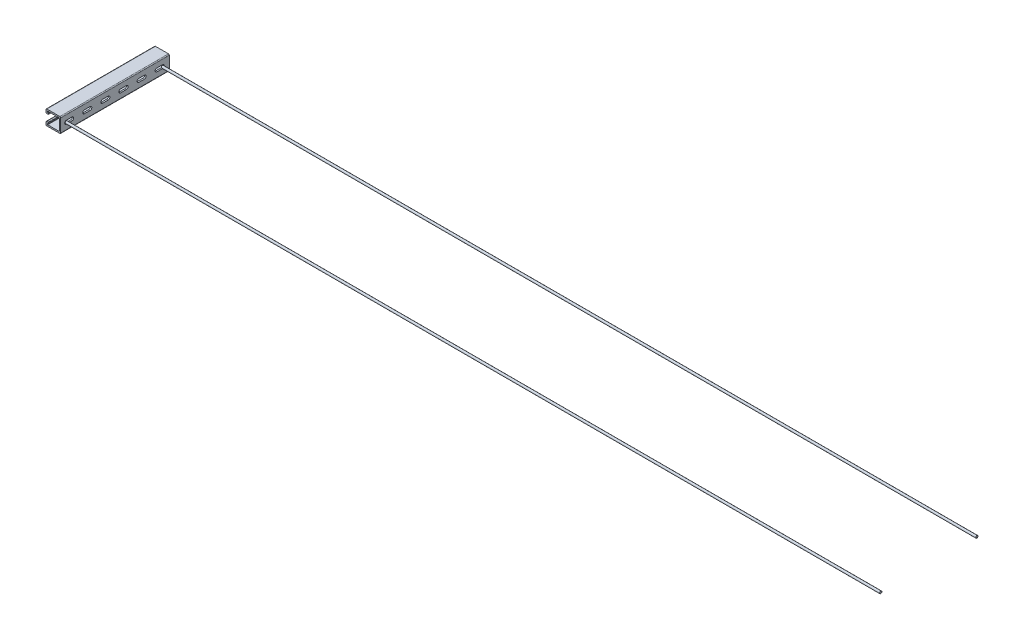
from build123d import *

# Parameters (mm, degrees)
EXTRUDE_THIN1_DEPTH   = 304.8
FILLET2_R             = 0.762
FILLET3_R             = 1.524
CUT_EXTRUDE1_DEPTH    = 309.273534432
LPATTERN1_COUNT       = 6
LPATTERN1_PITCH       = 50.8
SKETCH4_R             = 3.175
BOSS_EXTRUDE1_DEPTH   = 2286
BOSS_EXTRUDE1_2_DEPTH = 2286


with BuildPart() as part:
    # Sketch1 → Extrude-Thin1 (new body)
    with BuildSketch(Plane.XY):
        with BuildLine():
            Line((-13.5255, 9.525), (-18.2499, 9.525))
            ThreePointArc((-18.2499, 9.525), (-19.938188151, 10.224311849), (-20.6375, 11.9126))
            Line((-20.6375, 11.9126), (-20.6375, 18.2499))
            ThreePointArc((-20.6375, 18.2499), (-19.938188151, 19.938188151), (-18.2499, 20.6375))
            Line((-18.2499, 20.6375), (18.2499, 20.6375))
            ThreePointArc((18.2499, 20.6375), (19.938188151, 19.938188151), (20.6375, 18.2499))
            Line((20.6375, 18.2499), (20.6375, -18.2499))
            ThreePointArc((20.6375, -18.2499), (19.938188151, -19.938188151), (18.2499, -20.6375))
            Line((18.2499, -20.6375), (-18.2499, -20.6375))
            ThreePointArc((-18.2499, -20.6375), (-19.938188151, -19.938188151), (-20.6375, -18.2499))
            Line((-20.6375, -18.2499), (-20.6375, -11.9126))
            ThreePointArc((-20.6375, -11.9126), (-19.938188151, -10.224311849), (-18.2499, -9.525))
            Line((-18.2499, -9.525), (-13.5255, -9.525))
            Line((-13.5255, -9.525), (-13.5255, -13.589))
            Line((-13.5255, -13.589), (-16.5735, -13.589))
            Line((-16.5735, -13.589), (-16.5735, -16.5735))
            Line((-16.5735, -16.5735), (16.5735, -16.5735))
            Line((16.5735, -16.5735), (16.5735, 16.5735))
            Line((16.5735, 16.5735), (-16.5735, 16.5735))
            Line((-16.5735, 16.5735), (-16.5735, 13.589))
            Line((-16.5735, 13.589), (-13.5255, 13.589))
            Line((-13.5255, 13.589), (-13.5255, 9.525))
        make_face()
    extrude(amount=-EXTRUDE_THIN1_DEPTH)

    # Fillet2
    fillet2_edges = [part.edges().sort_by_distance(p)[0] for p in [
        (-16.5735, -13.589, -152.4),
        (-16.5735, -16.5735, -152.4),
        (-16.5735, 16.5735, -152.4),
        (-16.5735, 13.589, -152.4),
        (-13.5255, 13.589, -152.4),
        (-13.5255, 9.525, -152.4),
        (-13.5255, -9.525, -152.4),
        (-13.5255, -13.589, -152.4),
    ]]
    fillet(fillet2_edges, radius=FILLET2_R)

    # Fillet3
    fillet3_edges = [part.edges().sort_by_distance(p)[0] for p in [
        (16.5735, -16.5735, -152.4),
        (16.5735, 16.5735, -152.4),
    ]]
    fillet(fillet3_edges, radius=FILLET3_R)

    # Sketch2 → Cut-Extrude1 (cut, through all)
    with BuildSketch(Plane(origin=(20.6375, 0, 0), x_dir=(0, 0, -1), z_dir=(1, 0, 0))):
        with BuildLine():
            Line((15.875, 4.7625), (31.75, 4.7625))
            ThreePointArc((31.75, 4.7625), (36.5125, 0), (31.75, -4.7625))
            Line((31.75, -4.7625), (15.875, -4.7625))
            ThreePointArc((15.875, -4.7625), (11.1125, 0), (15.875, 4.7625))
        make_face()
    cut_extrude1 = extrude(amount=-CUT_EXTRUDE1_DEPTH, mode=Mode.SUBTRACT)

    # LPattern1: Cut-Extrude1 ×6
    with Locations(*[(0, 0, -i * LPATTERN1_PITCH) for i in range(1, LPATTERN1_COUNT)]):
        add(cut_extrude1, mode=Mode.SUBTRACT)


with BuildPart() as body_2:
    # Sketch4 → Boss-Extrude1 (new body)
    with BuildSketch(Plane(origin=(20.6375, 0, 0), x_dir=(0, 0, -1), z_dir=(1, 0, 0))):
        with Locations((15.875, 0)):
            Circle(SKETCH4_R)
    extrude(amount=BOSS_EXTRUDE1_DEPTH)


with BuildPart() as body_3:
    # Sketch4 → Boss-Extrude1 2 (new body)
    with BuildSketch(Plane(origin=(20.6375, 0, 0), x_dir=(0, 0, -1), z_dir=(1, 0, 0))):
        with Locations((285.75, 0)):
            Circle(SKETCH4_R)
    extrude(amount=BOSS_EXTRUDE1_2_DEPTH)


solid = Compound([part.part, body_2.part, body_3.part])
